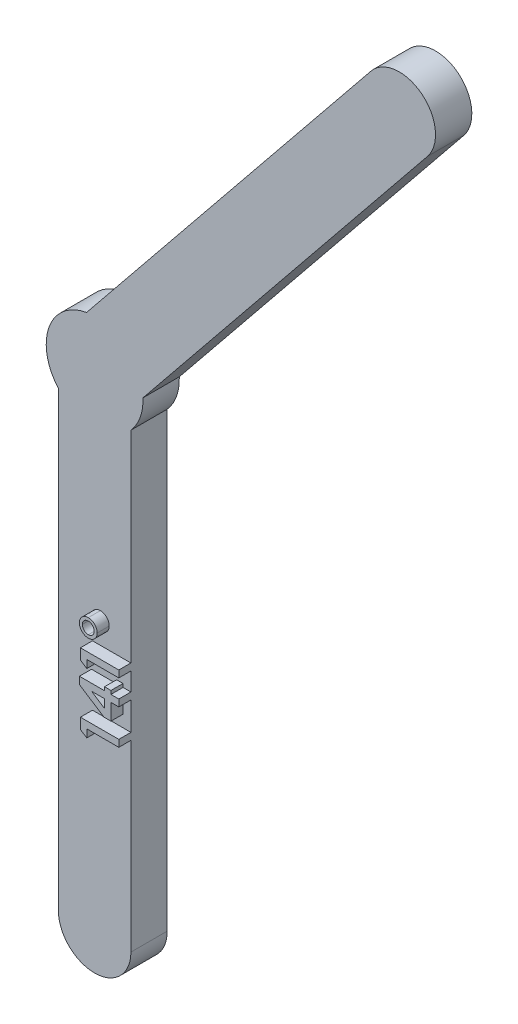
from build123d import *

# Parameters (mm, degrees)
BOSS_EXTRUDE1_DEPTH = 3
BOSS_EXTRUDE2_DEPTH = 1


with BuildPart() as part:
    # Sketch2 → Boss-Extrude1 (new body)
    with BuildSketch(Plane.XY):
        with BuildLine():
            Line((-3, -40), (-3, -2.645751311))
            ThreePointArc((-3, -2.645751311), (-3.770565964, 1.335227437), (-0.666412635, 3.94409612))
            Line((-0.666412635, 3.94409612), (22.841377758, 32.973799631))
            ThreePointArc((22.841377758, 32.973799631), (27.060776815, 33.417276343), (27.504253526, 29.197877285))
            Line((27.504253526, 29.197877285), (3.996463134, 0.168173773))
            ThreePointArc((3.996463134, 0.168173773), (3.770565964, -1.335227437), (3, -2.645751311))
            Line((3, -2.645751311), (3, -40))
            ThreePointArc((3, -40), (0, -43), (-3, -40))
        make_face()
    extrude(amount=BOSS_EXTRUDE1_DEPTH)

    # Sketch3 → Boss-Extrude2 (add)
    # profile 1 of 4: a face of its own
    with BuildSketch(Plane.XY.offset(3)):
        Polygon((-0.175, -25.154881865), (-0.175, -24.27399745), (3, -24.27399745), (3, -24.843869245), (0.354166667, -24.843869245), (0.354166667, -25.495151297), align=None)
    # profile 2 of 4: a face of its own
    with BuildSketch(Plane.XY.offset(3)):
        Polygon((-0.256410256, -21.977973813), (-0.256410256, -21.383933348), (1.819551282, -21.383933348), (1.819551282, -21.09899745), (2.348717949, -21.09899745), (2.348717949, -21.383933348), (3, -21.383933348), (3, -21.953805143), (2.348717949, -21.953805143), (2.348717949, -23.297074373), (1.77184996, -23.297074373), align=None)
        Polygon((1.819551282, -21.953805143), (0.738957332, -21.953805143), (1.819551282, -22.656604622), align=None, mode=Mode.SUBTRACT)
    # profile 3 of 4: a face of its own
    with BuildSketch(Plane.XY.offset(3)):
        Polygon((-0.175, -20.188856224), (-0.175, -19.307971809), (3, -19.307971809), (3, -19.877843604), (0.354166667, -19.877843604), (0.354166667, -20.529125656), align=None)
    # profile 4 of 4: a face of its own
    with BuildSketch(Plane.XY.offset(3)):
        with BuildLine():
            add(Edge.make_bspline(
                [(0.476282051, -16.824958989), (0.501543872, -16.825505484), (0.55122174, -16.826580176), (0.624352745, -16.837013476), (0.694208258, -16.854492691), (0.761803607, -16.876903338), (0.825395964, -16.908042089), (0.886396731, -16.944903837), (0.943669883, -16.989402672), (0.9978957, -17.039014969), (1.047295391, -17.093515132), (1.090947065, -17.151405488), (1.127096601, -17.212864468), (1.157366856, -17.276577248), (1.180332148, -17.343408663), (1.196689885, -17.412864586), (1.20741609, -17.485236986), (1.208449037, -17.534503871), (1.208974359, -17.559559349)],
                knots=[0, 0, 0, 0, 1.048753193, 2.062393874, 3.059725798, 4.03711221, 5.013824111, 5.993903926, 6.992478922, 8.020738441, 9.043061753, 10.043343452, 11.026424807, 11.999358773, 12.968420071, 13.955122655, 14.960044262, 16, 16, 16, 16], degree=3))
            add(Edge.make_bspline(
                [(1.208974359, -17.559559349), (1.208454225, -17.584616682), (1.207431478, -17.633887214), (1.196631189, -17.706233128), (1.180530583, -17.775855144), (1.156529218, -17.842391691), (1.126678292, -17.90615653), (1.090260147, -17.967072817), (1.046482503, -18.024600993), (0.996781055, -18.078582797), (0.942375086, -18.128107638), (0.88420218, -18.171482912), (0.823225465, -18.208946116), (0.758107997, -18.237837437), (0.69067286, -18.261947038), (0.619758864, -18.27798784), (0.545943315, -18.288833106), (0.495615647, -18.289833085), (0.469921875, -18.290343604)],
                knots=[0, 0, 0, 0, 1.037227242, 2.039512271, 3.023626077, 3.993053151, 4.963434463, 5.936395473, 6.927031705, 7.952593414, 8.972234493, 9.969891786, 10.954906455, 11.929570282, 12.915563215, 13.916770353, 14.936449251, 16, 16, 16, 16], degree=3))
            add(Edge.make_bspline(
                [(0.469921875, -18.290343604), (0.445290866, -18.289811451), (0.396869022, -18.288765297), (0.325492116, -18.278103661), (0.256787066, -18.261182775), (0.190979117, -18.23681523), (0.128167681, -18.205730248), (0.067236284, -18.169180135), (0.010175979, -18.123937412), (-0.044275745, -18.073515722), (-0.093962638, -18.018218509), (-0.137555056, -17.95952238), (-0.173973759, -17.89802202), (-0.203993097, -17.834134423), (-0.227847104, -17.767768562), (-0.244158222, -17.698411219), (-0.254789074, -17.626671533), (-0.255866772, -17.577830012), (-0.256410256, -17.553199173)],
                knots=[0, 0, 0, 0, 1.027628768, 2.020204677, 3.0054932, 3.977172113, 4.942988595, 5.928118098, 6.937247537, 7.976812879, 9.023474825, 10.036014018, 11.024160528, 12.002107364, 12.979092523, 13.962271943, 14.972371232, 16, 16, 16, 16], degree=3))
            add(Edge.make_bspline(
                [(-0.256410256, -17.553199173), (-0.255881051, -17.528566172), (-0.254836181, -17.479930408), (-0.244068832, -17.408427146), (-0.227959354, -17.339440503), (-0.203981879, -17.27352423), (-0.173948227, -17.210285117), (-0.137706982, -17.149501332), (-0.093944483, -17.091941849), (-0.043999627, -17.038019265), (0.009956511, -16.987787182), (0.068273488, -16.944627592), (0.128824771, -16.907104674), (0.192846684, -16.877455064), (0.259342082, -16.853394895), (0.329176204, -16.837233977), (0.401748506, -16.826543556), (0.451226198, -16.825491671), (0.476282051, -16.824958989)],
                knots=[0, 0, 0, 0, 1.02774298, 2.029191086, 3.012479778, 3.981238486, 4.951290381, 5.931946007, 6.930416638, 7.964088953, 8.997761269, 10.003308488, 10.98854748, 11.966603007, 12.943696749, 13.935593372, 14.954569896, 16, 16, 16, 16], degree=3))
        make_face()
        with BuildLine():
            add(Edge.make_bspline(
                [(0.479462139, -17.069189758), (0.462471258, -17.069424264), (0.428972226, -17.069886612), (0.379883793, -17.077505977), (0.332524379, -17.088023775), (0.287283463, -17.10328392), (0.24427911, -17.123234284), (0.203398935, -17.147571829), (0.164484674, -17.176174899), (0.128492582, -17.209237523), (0.095853701, -17.245103846), (0.066652511, -17.282897251), (0.042455186, -17.323086522), (0.023016589, -17.365273093), (0.006315159, -17.408801858), (-0.003707976, -17.454711924), (-0.01154919, -17.502263298), (-0.011966436, -17.534718897), (-0.012179487, -17.55129112)],
                knots=[0, 0, 0, 0, 1.061159961, 2.092171217, 3.098605391, 4.092036902, 5.070589041, 6.057187883, 7.061962211, 8.084674938, 9.107387665, 10.090954379, 11.06617917, 12.032717429, 12.99305519, 13.973669989, 14.965331307, 16, 16, 16, 16], degree=3))
            add(Edge.make_bspline(
                [(-0.012179487, -17.55129112), (-0.01157068, -17.568051412), (-0.01036426, -17.601263796), (-0.004409395, -17.650200831), (0.007572839, -17.69685371), (0.022606002, -17.742054962), (0.043122897, -17.784898142), (0.067542797, -17.826391236), (0.096744971, -17.865435361), (0.129769422, -17.902214665), (0.165718261, -17.935960463), (0.204573602, -17.964950546), (0.244977971, -17.990352408), (0.287582445, -18.010455361), (0.331832846, -18.026567734), (0.377821945, -18.038209426), (0.425871214, -18.044356322), (0.458458137, -18.045521173), (0.475010016, -18.046112835)],
                knots=[0, 0, 0, 0, 1.042034071, 2.064906527, 3.055369705, 4.030203466, 5.020228521, 6.000742353, 7.017744738, 8.043920206, 9.069249762, 10.075703201, 11.051782302, 12.029903876, 12.99669358, 13.974371501, 14.971122288, 16, 16, 16, 16], degree=3))
            add(Edge.make_bspline(
                [(0.475010016, -18.046112835), (0.491349767, -18.045520146), (0.523514051, -18.044353455), (0.570936909, -18.038223162), (0.616468237, -18.026465839), (0.660506807, -18.010425399), (0.703332854, -17.990458383), (0.743356347, -17.964229259), (0.782721478, -17.935019181), (0.819574977, -17.900938323), (0.853594861, -17.864058718), (0.883277913, -17.824563201), (0.908722399, -17.783622403), (0.929101491, -17.740636346), (0.945194342, -17.696373754), (0.956841315, -17.650387952), (0.962986781, -17.60233779), (0.964151827, -17.56975099), (0.96474359, -17.553199173)],
                knots=[0, 0, 0, 0, 1.017878107, 2.003660885, 2.970612419, 3.939454555, 4.919652619, 5.904816436, 6.913406512, 7.969270601, 9.02513469, 10.033724766, 11.041277553, 12.021475617, 12.990317753, 13.970071221, 14.968938047, 16, 16, 16, 16], degree=3))
            add(Edge.make_bspline(
                [(0.96474359, -17.553199173), (0.964515736, -17.536840687), (0.964066668, -17.504600367), (0.956359019, -17.457448889), (0.946146284, -17.411789288), (0.929505189, -17.368485652), (0.910263551, -17.326033898), (0.884925795, -17.286252494), (0.856415485, -17.247396305), (0.822504018, -17.212069657), (0.787116244, -17.177952839), (0.747777121, -17.149765554), (0.707718654, -17.124520148), (0.665616684, -17.10387006), (0.621397497, -17.089062601), (0.575848465, -17.07693948), (0.528165265, -17.071009446), (0.49579822, -17.069800121), (0.479462139, -17.069189758)],
                knots=[0, 0, 0, 0, 1.029744634, 2.029484694, 3.00508751, 3.97324883, 4.947661161, 5.937798898, 6.940036528, 7.980134083, 9.020231638, 10.033191535, 11.023329272, 12.003497406, 12.979740652, 13.958541426, 14.969648588, 16, 16, 16, 16], degree=3))
        make_face(mode=Mode.SUBTRACT)
    extrude(amount=BOSS_EXTRUDE2_DEPTH)


solid = part.part
